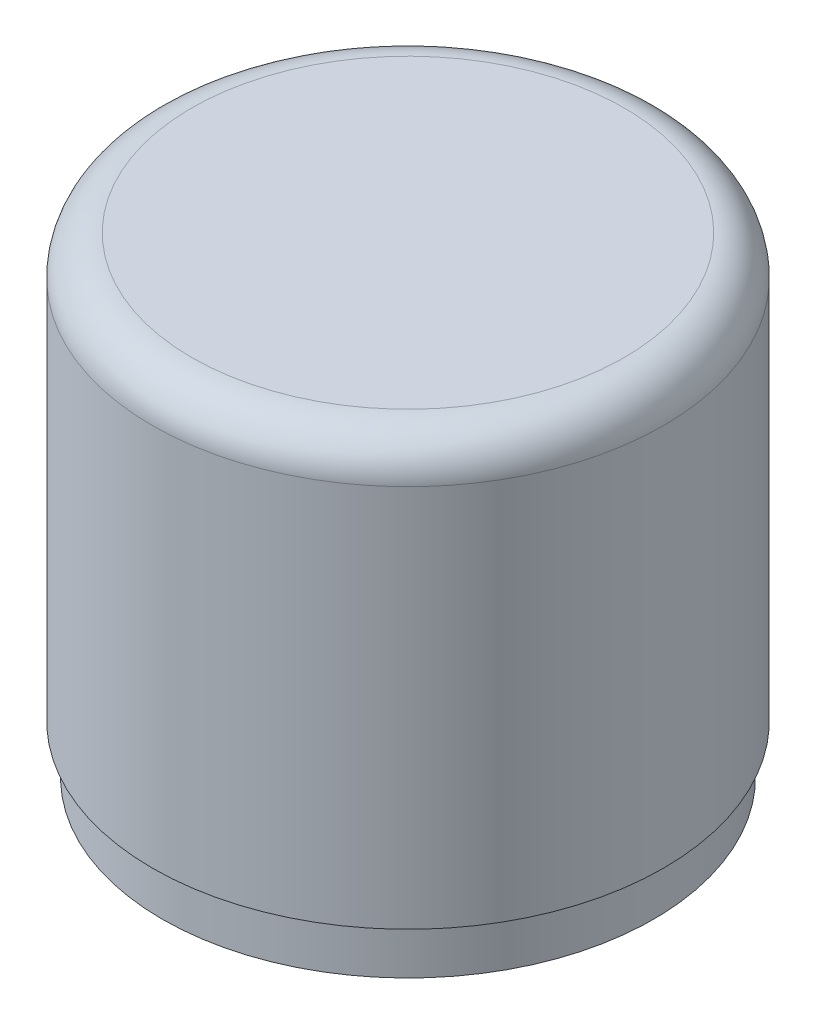
from build123d import *

# Parameters (mm, degrees)
SKETCH1_R           = 26
BOSS_EXTRUDE1_DEPTH = 43
SKETCH2_R           = 25
BOSS_EXTRUDE2_DEPTH = 5
SKETCH3_R           = 24.145878613
CUT_EXTRUDE1_DEPTH  = 44
FILLET1_R           = 4


with BuildPart() as part:
    # Sketch1 → Boss-Extrude1 (new body)
    with BuildSketch(Plane(origin=(0, 0, 0), x_dir=(1, 0, 0), z_dir=(0, 1, 0))):
        with Locations(Location((0, 0, 0), (0, 0, 270))):
            Circle(SKETCH1_R)
    extrude(amount=BOSS_EXTRUDE1_DEPTH)

    # Sketch2 → Boss-Extrude2 (add)
    with BuildSketch(Plane.XZ):
        with Locations(Location((0, 0, 0), (0, 0, 270))):
            Circle(SKETCH2_R)
    extrude(amount=BOSS_EXTRUDE2_DEPTH)

    # Sketch3 → Cut-Extrude1 (cut)
    with BuildSketch(Plane.XZ.offset(5)):
        with Locations(Location((0, 0, 0), (0, 0, 270))):
            Circle(SKETCH3_R)
    extrude(amount=-CUT_EXTRUDE1_DEPTH, mode=Mode.SUBTRACT)

    # Fillet1
    fillet1_edges = [part.edges().sort_by_distance(p)[0] for p in [
        (0, 43, -26),
    ]]
    fillet(fillet1_edges, radius=FILLET1_R)


solid = part.part
